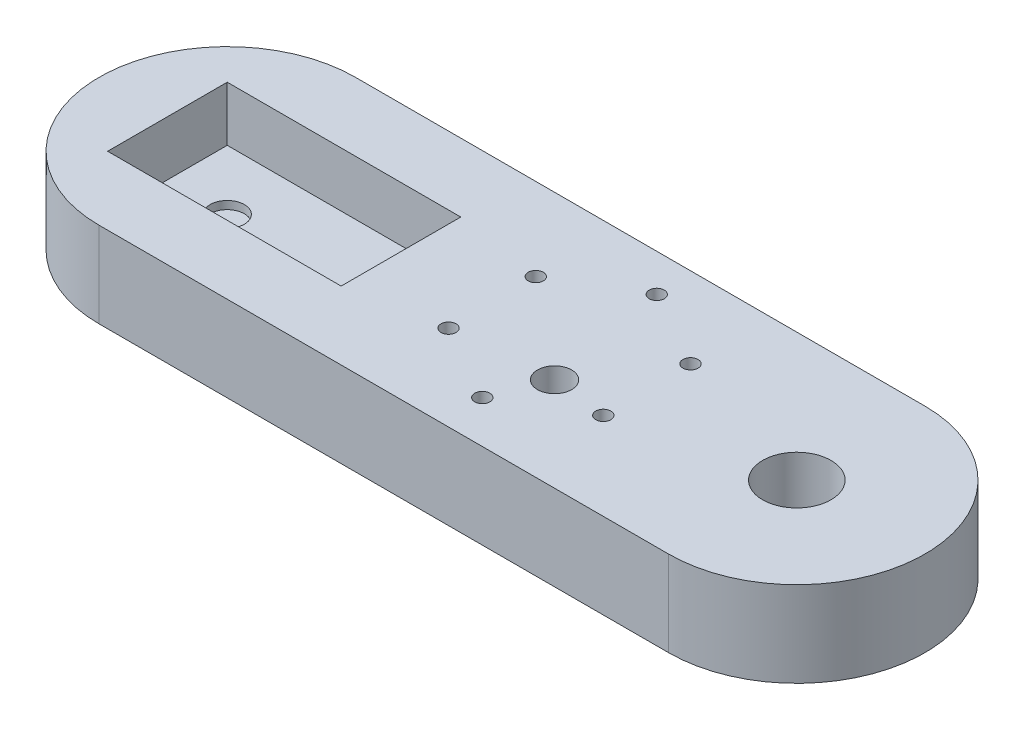
from build123d import *

# Parameters (mm, degrees)
BOSS_EXTRUDE1_DEPTH     = 15
SKETCH2_R               = 10
BOSS_EXTRUDE2_DEPTH     = 9
CUT_EXTRUDE1_START      = -15
SKETCH3_R               = 3
CUT_EXTRUDE1_DEPTH      = 15
SKETCH4_W               = 41
SKETCH4_H               = 21
CUT_EXTRUDE2_DEPTH      = 9.6
SKETCH5_W               = 25
SKETCH5_H               = 4
CUT_EXTRUDE3_DEPTH      = 25
CUT_EXTRUDE4_DEPTH      = 127.840450961
CUT_EXTRUDE4_DEPTH_BACK = 127.840450961
SKETCH6_R               = 6
SKETCH7_R               = 3
CUT_EXTRUDE5_DEPTH      = 127.840450961
SKETCH8_R               = 1.325011821
CUT_EXTRUDE6_DEPTH      = 126.449192903


with BuildPart() as part:
    # Sketch1 → Boss-Extrude1 (new body)
    with BuildSketch(Plane(origin=(0, 0, 0), x_dir=(1, 0, 0), z_dir=(0, 1, 0))):
        with BuildLine():
            Line((0, 22.5), (100, 22.5))
            ThreePointArc((100, 22.5), (122.5, 0), (100, -22.5))
            Line((100, -22.5), (0, -22.5))
            ThreePointArc((0, -22.5), (-22.5, 0), (0, 22.5))
        make_face()
    extrude(amount=BOSS_EXTRUDE1_DEPTH)

    # Sketch2 → Boss-Extrude2 (add)
    with BuildSketch(Plane.XZ):
        with Locations(Location((0, 0, 0), (0, 0, 90))):
            Circle(SKETCH2_R)
    extrude(amount=BOSS_EXTRUDE2_DEPTH)

    # Sketch3 → Cut-Extrude1 (cut)
    with BuildSketch(Plane(origin=(0, 15, 0), x_dir=(1, 0, 0), z_dir=(0, 1, 0)).offset(CUT_EXTRUDE1_START)):
        with Locations(Location((0, 0, 0), (0, 0, 270))):
            Circle(SKETCH3_R)
    extrude(amount=CUT_EXTRUDE1_DEPTH, mode=Mode.SUBTRACT)

    # Sketch4 → Cut-Extrude2 (cut)
    with BuildSketch(Plane(origin=(0, 15, 0), x_dir=(1, 0, 0), z_dir=(0, 1, 0))):
        with Locations((10, 0)):
            Rectangle(SKETCH4_W, SKETCH4_H)
    extrude(amount=-CUT_EXTRUDE2_DEPTH, mode=Mode.SUBTRACT)

    # Sketch5 → Cut-Extrude3 (cut)
    with BuildSketch(Plane(origin=(-22.5, 15, 0), x_dir=(0, 0, 1), z_dir=(-1, 0, 0))):
        with Locations((0, -13)):
            Rectangle(SKETCH5_W, SKETCH5_H)
    extrude(amount=-CUT_EXTRUDE3_DEPTH, mode=Mode.SUBTRACT)

    # Sketch6 → Cut-Extrude4 (cut, two sides: drawn at the far end of the back side and taken through both)
    with BuildSketch(Plane(origin=(0, 15, 0), x_dir=(1, 0, 0), z_dir=(0, 1, 0)).offset(-CUT_EXTRUDE4_DEPTH_BACK)):
        with Locations(Location((100, 0, 0), (0, 0, 270))):
            Circle(SKETCH6_R)
    extrude(amount=CUT_EXTRUDE4_DEPTH + CUT_EXTRUDE4_DEPTH_BACK, mode=Mode.SUBTRACT)

    # Sketch7 → Cut-Extrude5 (cut, through all)
    with BuildSketch(Plane(origin=(0, 15, 0), x_dir=(1, 0, 0), z_dir=(0, 1, 0))):
        with Locations(Location((63.480653876, -6.00928668, 0), (0, 0, 270))):
            Circle(SKETCH7_R)
    extrude(amount=-CUT_EXTRUDE5_DEPTH, mode=Mode.SUBTRACT)

    # Sketch8 → Cut-Extrude6 (cut, through all)
    with BuildSketch(Plane.XZ):
        with Locations(Location((46.139135996, -8.030751211, 0), (0, 0, 270))):
            Circle(SKETCH8_R)
        with Locations(Location((46.323389896, 7.468153605, 0), (0, 0, 270))):
            Circle(SKETCH8_R)
        with Locations(Location((59.837962148, 15.058037455, 0), (0, 0, 270))):
            Circle(SKETCH8_R)
        with Locations(Location((73.168280499, 7.149016489, 0), (0, 0, 270))):
            Circle(SKETCH8_R)
        with Locations(Location((72.984026599, -8.349888327, 0), (0, 0, 270))):
            Circle(SKETCH8_R)
        with Locations(Location((59.469454347, -15.939772177, 0), (0, 0, 270))):
            Circle(SKETCH8_R)
    extrude(amount=-CUT_EXTRUDE6_DEPTH, mode=Mode.SUBTRACT)


solid = part.part
